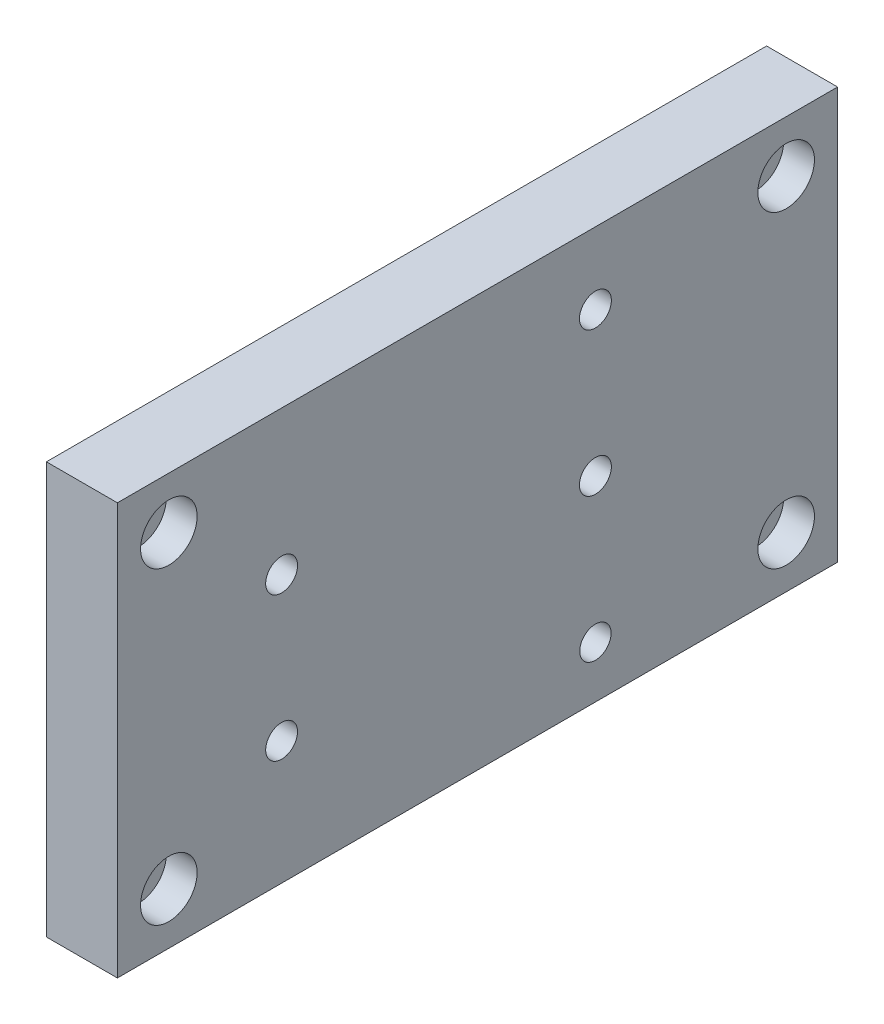
from build123d import *

# Parameters (mm, degrees)
SKETCH_1_W          = 70
SKETCH_1_H          = 40
EXTRUDE_3_DEPTH     = 6.9
SKETCH_2_R          = 1.5
CUT_EXTRUDE_1_DEPTH = 6.9
SKETCH_5_R          = 2.75
CUT_EXTRUDE_3_DEPTH = 3
SKETCH_6_R          = 1.52480842
SKETCH_6_R_2        = 1.55
CUT_EXTRUDE_4_DEPTH = 10
SKETCH_7_R          = 3
CUT_EXTRUDE_6_DEPTH = 3


with BuildPart() as part:
    # 草图1 → 凸台-拉伸3 (new body)
    with BuildSketch(Plane(origin=(0, 0, 0), x_dir=(0, 0, -1), z_dir=(1, 0, 0))):
        with Locations((35, 20)):
            Rectangle(SKETCH_1_W, SKETCH_1_H)
    extrude(amount=EXTRUDE_3_DEPTH)

    # 草图2 → 切除-拉伸1 (cut)
    with BuildSketch(Plane(origin=(6.9, 0, 0), x_dir=(0, 0, -1), z_dir=(1, 0, 0))):
        with BuildLine():
            ThreePointArc((6.5, 35), (6.060660172, 36.060660172), (5, 36.5))
            Line((5, 36.5), (5, 35))
            Line((5, 35), (3.5, 35))
            ThreePointArc((3.5, 35), (5, 33.5), (6.5, 35))
        make_face()
        with BuildLine():
            Line((5, 35), (5, 36.5))
            ThreePointArc((5, 36.5), (3.939339828, 36.060660172), (3.5, 35))
            Line((3.5, 35), (5, 35))
        make_face()
        with Locations((5, 5)):
            Circle(SKETCH_2_R)
        with Locations((65, 5)):
            Circle(SKETCH_2_R)
        with Locations((65, 35)):
            Circle(SKETCH_2_R)
    extrude(amount=-CUT_EXTRUDE_1_DEPTH, mode=Mode.SUBTRACT)

    # 草图5 → 切除-拉伸3 (cut)
    with BuildSketch(Plane(origin=(6.9, 0, 0), x_dir=(0, 0, -1), z_dir=(1, 0, 0))):
        with Locations((5, 35)):
            Circle(SKETCH_5_R)
        with Locations((5, 5)):
            Circle(SKETCH_5_R)
        with Locations((65, 35)):
            Circle(SKETCH_5_R)
        with Locations((65, 5)):
            Circle(SKETCH_5_R)
    extrude(amount=-CUT_EXTRUDE_3_DEPTH, mode=Mode.SUBTRACT)

    # 草图6 → 切除-拉伸4 (cut)
    with BuildSketch(Plane(origin=(6.9, 0, 0), x_dir=(0, 0, -1), z_dir=(1, 0, 0))):
        with Locations((46.461053437, 5.03563892)):
            Circle(SKETCH_6_R)
        with Locations((46.461053437, 19.03563892)):
            Circle(SKETCH_6_R_2)
        with Locations((46.461053437, 33.03563892)):
            Circle(SKETCH_6_R_2)
        with Locations((15.961053437, 25.98563892)):
            Circle(SKETCH_6_R_2)
        with Locations((15.961053437, 11.98563892)):
            Circle(SKETCH_6_R_2)
    extrude(amount=-CUT_EXTRUDE_4_DEPTH, mode=Mode.SUBTRACT)

    # 草图7 → 切除-拉伸6 (cut)
    with BuildSketch(Plane.ZY):
        with Locations((-46.461053437, 33.03563892)):
            Circle(SKETCH_7_R)
        with Locations((-46.461053437, 19.03563892)):
            Circle(SKETCH_7_R)
        with Locations((-46.461053437, 5.03563892)):
            Circle(SKETCH_7_R)
        with Locations((-15.961053437, 11.98563892)):
            Circle(SKETCH_7_R)
        with Locations((-15.961053437, 25.98563892)):
            Circle(SKETCH_7_R)
    extrude(amount=-CUT_EXTRUDE_6_DEPTH, mode=Mode.SUBTRACT)


solid = part.part
